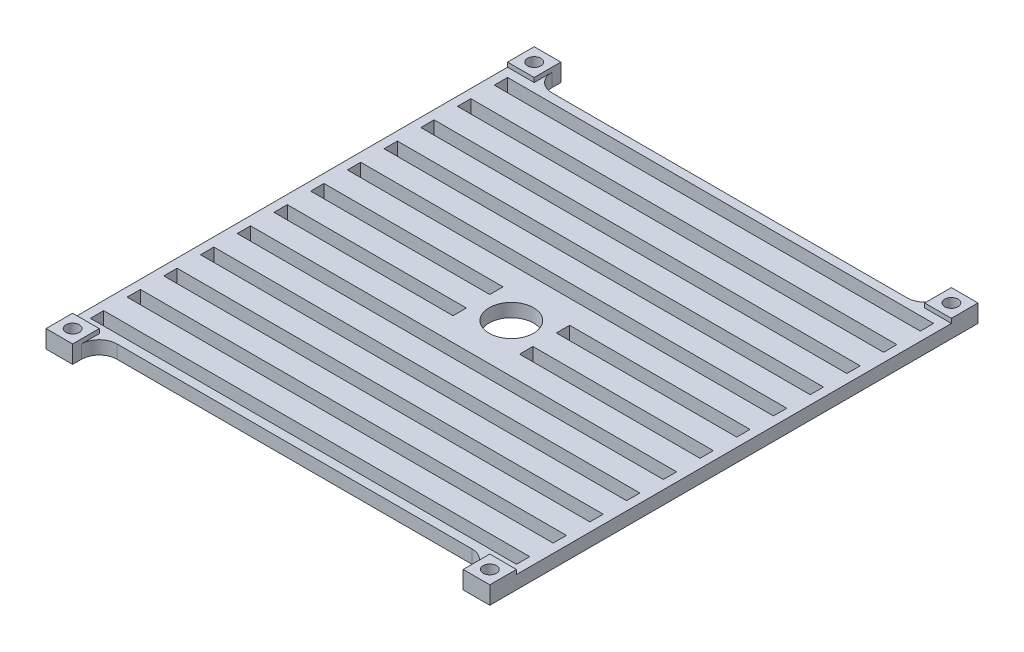
from build123d import *

# Parameters (mm, degrees)
SKETCH1_W           = 100
SKETCH1_H           = 98
SKETCH1_W_2         = 96
SKETCH1_H_2         = 3
SKETCH1_W_3         = 40.347954038
SKETCH1_W_4         = 40.652045962
SKETCH1_R           = 5
BOSS_EXTRUDE4_DEPTH = 3
SKETCH1_8_W         = 6
SKETCH1_8_H         = 6
SKETCH1_8_R         = 1.5
BOSS_EXTRUDE6_DEPTH = 4
FILLET3_R           = 4


with BuildPart() as part:
    # Sketch1 → Boss-Extrude4 (new body)
    with BuildSketch(Plane(origin=(0, 0, 0), x_dir=(1, 0, 0), z_dir=(0, 1, 0))):
        Rectangle(SKETCH1_W, SKETCH1_H)
        with Locations((0, -37.227272727)):
            Rectangle(SKETCH1_W_2, SKETCH1_H_2, mode=Mode.SUBTRACT)
        with Locations((0, -28.954545455)):
            Rectangle(SKETCH1_W_2, SKETCH1_H_2, mode=Mode.SUBTRACT)
        with Locations((0, -20.681818182)):
            Rectangle(SKETCH1_W_2, SKETCH1_H_2, mode=Mode.SUBTRACT)
        with Locations((0, -12.409090909)):
            Rectangle(SKETCH1_W_2, SKETCH1_H_2, mode=Mode.SUBTRACT)
        with Locations((0, -45.5)):
            Rectangle(SKETCH1_W_2, SKETCH1_H_2, mode=Mode.SUBTRACT)
        with Locations((-27.826022981, -4.136363636)):
            Rectangle(SKETCH1_W_3, SKETCH1_H_2, mode=Mode.SUBTRACT)
        with Locations((27.673977019, -4.136363636)):
            Rectangle(SKETCH1_W_4, SKETCH1_H_2, mode=Mode.SUBTRACT)
        with Locations((27.673977019, 4.136363636)):
            Rectangle(SKETCH1_W_4, SKETCH1_H_2, mode=Mode.SUBTRACT)
        with Locations((-27.826022981, 4.136363636)):
            Rectangle(SKETCH1_W_3, SKETCH1_H_2, mode=Mode.SUBTRACT)
        with Locations((0, 12.409090909)):
            Rectangle(SKETCH1_W_2, SKETCH1_H_2, mode=Mode.SUBTRACT)
        with Locations((0, 20.681818182)):
            Rectangle(SKETCH1_W_2, SKETCH1_H_2, mode=Mode.SUBTRACT)
        with Locations((0, 28.954545455)):
            Rectangle(SKETCH1_W_2, SKETCH1_H_2, mode=Mode.SUBTRACT)
        with Locations((0, 37.227272727)):
            Rectangle(SKETCH1_W_2, SKETCH1_H_2, mode=Mode.SUBTRACT)
        with Locations((0, 45.5)):
            Rectangle(SKETCH1_W_2, SKETCH1_H_2, mode=Mode.SUBTRACT)
        with Locations((-0.152045962, 0)):
            Circle(SKETCH1_R, mode=Mode.SUBTRACT)
    extrude(amount=BOSS_EXTRUDE4_DEPTH)

    # Sketch1<8> → Boss-Extrude6 (add)
    # profile 1 of 4: a face of its own
    with BuildSketch(Plane(origin=(0, 0, 0), x_dir=(1, 0, 0), z_dir=(0, 1, 0))):
        with Locations((47, 52)):
            Rectangle(SKETCH1_8_W, SKETCH1_8_H)
        with Locations((47, 52)):
            Circle(SKETCH1_8_R, mode=Mode.SUBTRACT)
    # profile 2 of 4: a face of its own
    with BuildSketch(Plane(origin=(0, 0, 0), x_dir=(1, 0, 0), z_dir=(0, 1, 0))):
        with Locations((47, -52)):
            Rectangle(SKETCH1_8_W, SKETCH1_8_H)
        with Locations((47, -52)):
            Circle(SKETCH1_8_R, mode=Mode.SUBTRACT)
    # profile 3 of 4: a face of its own
    with BuildSketch(Plane(origin=(0, 0, 0), x_dir=(1, 0, 0), z_dir=(0, 1, 0))):
        with Locations((-47, 52)):
            Rectangle(SKETCH1_8_W, SKETCH1_8_H)
        with Locations((-47, 52)):
            Circle(SKETCH1_8_R, mode=Mode.SUBTRACT)
    # profile 4 of 4: a face of its own
    with BuildSketch(Plane(origin=(0, 0, 0), x_dir=(1, 0, 0), z_dir=(0, 1, 0))):
        with Locations((-47, -52)):
            Rectangle(SKETCH1_8_W, SKETCH1_8_H)
        with Locations((-47, -52)):
            Circle(SKETCH1_8_R, mode=Mode.SUBTRACT)
    extrude(amount=BOSS_EXTRUDE6_DEPTH)

    # Fillet3
    fillet3_edges = [part.edges().sort_by_distance(p)[0] for p in [
        (44, 1.5, -49),
        (-44, 1.5, -49),
        (-44, 1.5, 49),
        (44, 1.5, 49),
    ]]
    fillet(fillet3_edges, radius=FILLET3_R)


solid = part.part
